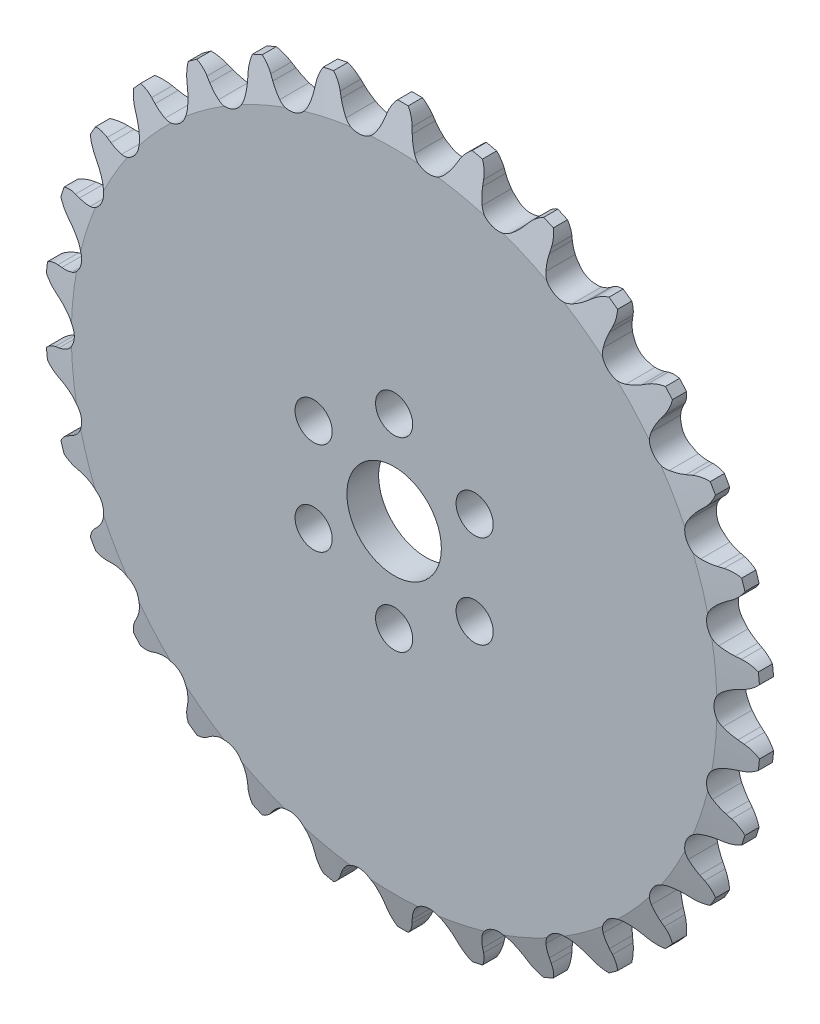
from build123d import *

# Parameters (mm, degrees)
CUT_EXTRUDE1_DEPTH          = 69.155591667
CIRPATTERN1_COUNT           = 30
CUT_EXTRUDE2_DEPTH          = 69.015961799
CUT_EXTRUDE2_DEPTH_BACK     = 69.015961799
SKETCH3_OUTSIDE_W           = 125.15
SKETCH3_OUTSIDE_H           = 125.546
SKETCH3_OUTSIDE_R           = 48.133
SKETCH3_OUTSIDE_R_2         = 6.35
TAP_DRILL_FOR_M6X1_0_TAP1_D = 5
CIRPATTERN2_COUNT           = 6


with BuildPart() as part:
    # Sketch1 → Revolve1 (revolve)
    with BuildSketch(Plane(origin=(0, 0, 0), x_dir=(0, 0, -1), z_dir=(1, 0, 0)), mode=Mode.PRIVATE) as revolve1_sk:
        Polygon((2.1336, 0), (-2.1336, 0), (-2.1336, 43.407160713), (-0.942975, 48.169660713), (0.942975, 48.169660713), (2.1336, 43.407160713), align=None)
    revolve(revolve1_sk.sketch.rotate(Axis((0, 0, -2.1336), (0, 0, 1)), 90), axis=Axis((0, 0, -2.1336), (0, 0, 1)))

    # Sketch0 → Cut-Extrude1 (cut, symmetric)
    with BuildSketch(Plane.XY):
        with BuildLine():
            Line((8.008399497, -45.713317718), (7.694113983, -45.092932861))
            ThreePointArc((7.694113983, -45.092932861), (7.216003843, -44.294069029), (6.630523625, -43.570200502))
            ThreePointArc((6.630523625, -43.570200502), (4.495513399, -42.771952888), (2.573123281, -43.996650462))
            ThreePointArc((2.573123281, -43.996650462), (2.150937939, -44.826428907), (1.849368783, -45.707240336))
            Line((1.849368783, -45.707240336), (1.670936426, -46.379411928))
            ThreePointArc((1.670936426, -46.379411928), (0.100345022, -48.673885505), (-2.564895945, -49.466259748))
            ThreePointArc((-2.564895945, -49.466259748), (5.177578253, -49.261366487), (12.793460518, -47.852031437))
            ThreePointArc((12.793460518, -47.852031437), (10.021717592, -47.631107228), (8.008399497, -45.713317718))
        make_face()
    cut_extrude1 = extrude(amount=CUT_EXTRUDE1_DEPTH, both=True, mode=Mode.SUBTRACT)

    # CirPattern1: Cut-Extrude1 ×30 about axis
    cirpattern1_axis = Axis((0, 0, 0), (0, 0, 1))
    for i in range(1, CIRPATTERN1_COUNT):
        add(cut_extrude1.rotate(cirpattern1_axis, i * 360 / CIRPATTERN1_COUNT), mode=Mode.SUBTRACT)

    # Sketch3 outside → Cut-Extrude2 (cut, two sides: drawn at the far end of the back side and taken through both)
    # profile 1 of 2: a face of its own
    with BuildSketch(Plane.XY.offset(-CUT_EXTRUDE2_DEPTH_BACK)):
        Rectangle(SKETCH3_OUTSIDE_W, SKETCH3_OUTSIDE_H)
        Circle(SKETCH3_OUTSIDE_R, mode=Mode.SUBTRACT)
    # profile 2 of 2: a face of its own
    with BuildSketch(Plane.XY.offset(-CUT_EXTRUDE2_DEPTH_BACK)):
        Circle(SKETCH3_OUTSIDE_R_2)
    extrude(amount=CUT_EXTRUDE2_DEPTH + CUT_EXTRUDE2_DEPTH_BACK, mode=Mode.SUBTRACT)

    # Tap Drill for M6x1.0 Tap1 (through all)
    with Locations(Plane.XY.offset(2.1336)):
        with Locations((0, 12.5)):
            tap_drill_for_m6x1_0_tap1 = Hole(TAP_DRILL_FOR_M6X1_0_TAP1_D / 2)

    # CirPattern2: Tap Drill for M6x1.0 Tap1 ×6 about axis
    cirpattern2_axis = Axis((0, 0, 0), (0, 0, 1))
    for i in range(1, CIRPATTERN2_COUNT):
        add(tap_drill_for_m6x1_0_tap1.rotate(cirpattern2_axis, i * 360 / CIRPATTERN2_COUNT), mode=Mode.SUBTRACT)


solid = part.part
